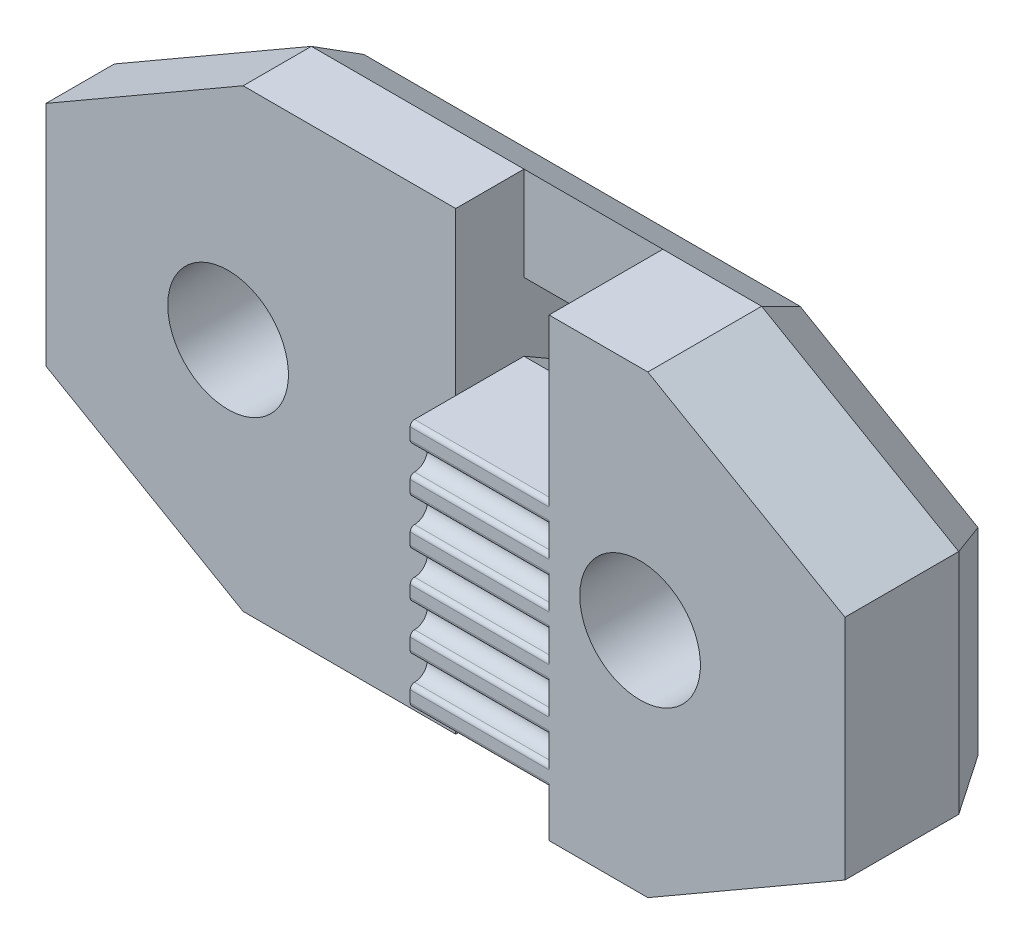
from build123d import *
from OCP.BRepFilletAPI import BRepFilletAPI_MakeChamfer

# Parameters (mm, degrees)
AUFSATZ_LINEAR_AUSTRAGEN1_DEPTH    = 6.1
AUFSATZ_LINEAR_AUSTRAGEN1_2_DEPTH  = 6.1
SKIZZE2_W                          = 6
SKIZZE2_H                          = 10.88
SCHNITT_LINEAR_AUSTRAGEN1_DEPTH    = 6.1
SKIZZE3_R                          = 2.65
SKIZZE3_W                          = 6.1
SKIZZE3_H                          = 4.12
AUFSATZ_LINEAR_AUSTRAGEN2_DEPTH    = 2.19
SKIZZE4_R                          = 2.65
AUFSATZ_LINEAR_AUSTRAGEN3_DEPTH    = 4.81
SKIZZE5_R                          = 2.65
AUFSATZ_LINEAR_AUSTRAGEN4_DEPTH    = 0.19
FASE1_SIZE                         = 5
FASE1_SIZE2                        = 8.660254038
FASE2_SIZE                         = 2
FASE2_SIZE2                        = 1.154700538
SCHNITT_LINEAR_START               = -4
SCHNITT_LINEAR_AUSTRAGEN3_DEPTH    = 2.5
SCHNITT_LINEAR_AUSTRAGEN4_REACH    = 36.325
SKIZZE12_W                         = 5
SKIZZE12_H                         = 6.1
K_RPER_VERSCHIEBEN_KOPIEREN1_ANGLE = 90


with BuildPart() as part:
    # Skizze1 → Aufsatz-Linear austragen1 (new body)
    with BuildSketch(Plane.XY):
        Polygon((0, 0), (0, 9.44), (0, 10.88), (-6, 10.88), (-6, 0), align=None)
    extrude(amount=AUFSATZ_LINEAR_AUSTRAGEN1_DEPTH)

    # Skizze2 → Schnitt-Linear austragen1 (cut)
    with BuildSketch(Plane.XY.offset(6.1)):
        with Locations((-3, 5.44)):
            Rectangle(SKIZZE2_W, SKIZZE2_H)
    extrude(amount=-SCHNITT_LINEAR_AUSTRAGEN1_DEPTH, mode=Mode.SUBTRACT)


with BuildPart() as body_2:
    # Skizze1 → Aufsatz-Linear austragen1 2 (new body)
    with BuildSketch(Plane.XY):
        with BuildLine():
            Line((-7.05, 10.19), (-7.05, 10.69))
            ThreePointArc((-7.05, 10.69), (-7.105649712, 10.824350288), (-7.24, 10.88))
            Line((-7.24, 10.88), (-9.24, 10.88))
            Line((-9.24, 10.88), (-9.24, 0))
            Line((-9.24, 0), (-7.24, 0))
            ThreePointArc((-7.24, 0), (-7.105649712, 0.055649712), (-7.05, 0.19))
            Line((-7.05, 0.19), (-7.05, 0.69))
            ThreePointArc((-7.05, 0.69), (-7.105649712, 0.824350288), (-7.24, 0.88))
            ThreePointArc((-7.24, 0.88), (-7.8, 1.44), (-7.24, 2))
            ThreePointArc((-7.24, 2), (-7.105649712, 2.055649712), (-7.05, 2.19))
            Line((-7.05, 2.19), (-7.05, 2.69))
            ThreePointArc((-7.05, 2.69), (-7.105649712, 2.824350288), (-7.24, 2.88))
            ThreePointArc((-7.24, 2.88), (-7.8, 3.44), (-7.24, 4))
            ThreePointArc((-7.24, 4), (-7.105649712, 4.055649712), (-7.05, 4.19))
            Line((-7.05, 4.19), (-7.05, 4.69))
            ThreePointArc((-7.05, 4.69), (-7.105649712, 4.824350288), (-7.24, 4.88))
            ThreePointArc((-7.24, 4.88), (-7.8, 5.44), (-7.24, 6))
            ThreePointArc((-7.24, 6), (-7.105649712, 6.055649712), (-7.05, 6.19))
            Line((-7.05, 6.19), (-7.05, 6.69))
            ThreePointArc((-7.05, 6.69), (-7.105649712, 6.824350288), (-7.24, 6.88))
            ThreePointArc((-7.24, 6.88), (-7.8, 7.44), (-7.24, 8))
            ThreePointArc((-7.24, 8), (-7.105649712, 8.055649712), (-7.05, 8.19))
            Line((-7.05, 8.19), (-7.05, 8.69))
            ThreePointArc((-7.05, 8.69), (-7.105649712, 8.824350288), (-7.24, 8.88))
            ThreePointArc((-7.24, 8.88), (-7.8, 9.44), (-7.24, 10))
            ThreePointArc((-7.24, 10), (-7.105649712, 10.055649712), (-7.05, 10.19))
        make_face()
    extrude(amount=AUFSATZ_LINEAR_AUSTRAGEN1_2_DEPTH)

    # Skizze3 → Aufsatz-Linear austragen2 (add)
    # profile 1 of 2: a face of its own
    with BuildSketch(Plane.ZY.offset(9.24)):
        Polygon((-13, -2), (0, -2), (0, 13.88), (0, 18), (-13, 18), align=None)
        with Locations((-4, 8)):
            Circle(SKIZZE3_R, mode=Mode.SUBTRACT)
    # profile 2 of 2: a face of its own
    with BuildSketch(Plane.ZY.offset(9.24)):
        with Locations((3.05, 15.94)):
            Rectangle(SKIZZE3_W, SKIZZE3_H)
    extrude(amount=-AUFSATZ_LINEAR_AUSTRAGEN2_DEPTH)

    # Skizze4 → Aufsatz-Linear austragen3 (add)
    # profile 1 of 2: a face of its own
    with BuildSketch(Plane.ZY.offset(9.24)):
        Polygon((24.1, 18), (6.1, 18), (6.1, 13.88), (6.1, 10.88), (6.1, 0), (6.1, -2), (24.1, -2), align=None)
        with Locations((16.1, 8)):
            Circle(SKIZZE4_R, mode=Mode.SUBTRACT)
    # profile 2 of 2: a face of its own
    with BuildSketch(Plane.ZY.offset(9.24)):
        Polygon((6.1, 0), (6.1, 10.88), (0, 10.88), (0, 13.88), (6.1, 13.88), (6.1, 18), (-13, 18), (-13, -2), (0, -2), (0, 0), align=None)
        with Locations((-4, 8)):
            Circle(SKIZZE4_R, mode=Mode.SUBTRACT)
    extrude(amount=AUFSATZ_LINEAR_AUSTRAGEN3_DEPTH)

    # Skizze5 → Aufsatz-Linear austragen4 (add)
    with BuildSketch(Plane(origin=(-9.24, 0, 0), x_dir=(0, 0, -1), z_dir=(1, 0, 0))):
        Polygon((-6.1, 13.88), (-6.1, 18), (-24.1, 18), (-24.1, -2), (-6.1, -2), (-6.1, 0), (-6.1, 10.88), align=None)
        with Locations(Location((-16.1, 8, 0), (0, 0, 180))):
            Circle(SKIZZE5_R, mode=Mode.SUBTRACT)
    extrude(amount=AUFSATZ_LINEAR_AUSTRAGEN4_DEPTH)

    # Fase1: one chamfer whose edges measure the first distance from different faces: ONE call of the kernel's chamfer builder (chamfer() names one face for all edges)
    fase1_edges_1 = [body_2.edges().sort_by_distance(p)[0] for p in [
        (-11.645, -2, 24.1),
        (-11.645, 18, 24.1),
    ]]
    fase1_side_1 = [body_2.faces().sort_by_distance(p)[0] for p in [
        (-11.645, 8, 24.1),
    ]]
    fase1_edges_2 = [body_2.edges().sort_by_distance(p)[0] for p in [
        (-10.55, -2, -13),
        (-10.55, 18, -13),
    ]]
    fase1_side_2 = [body_2.faces().sort_by_distance(p)[0] for p in [
        (-10.55, 8, -13),
    ]]
    fase1 = BRepFilletAPI_MakeChamfer(body_2.part.solid().wrapped)
    for e in fase1_edges_1:
        fase1.Add(FASE1_SIZE, FASE1_SIZE2, e.wrapped, fase1_side_1[0].wrapped)  # the first distance lies on this face
    for e in fase1_edges_2:
        fase1.Add(FASE1_SIZE, FASE1_SIZE2, e.wrapped, fase1_side_2[0].wrapped)  # the first distance lies on this face
    add(Compound.cast(fase1.Shape()), mode=Mode.REPLACE)

    # Fase2: one chamfer whose edges measure the first distance from different faces: ONE call of the kernel's chamfer builder (chamfer() names one face for all edges)
    fase2_edges_1 = [body_2.edges().sort_by_distance(p)[0] for p in [
        (-14.05, -2, 10.769872981),
    ]]
    fase2_side_1 = [body_2.faces().sort_by_distance(p)[0] for p in [
        (-11.645, -2, 10.769872981),
    ]]
    fase2_edges_2 = [body_2.edges().sort_by_distance(p)[0] for p in [
        (-14.05, 10.88, 3.05),
    ]]
    fase2_side_2 = [body_2.faces().sort_by_distance(p)[0] for p in [
        (-11.645, 10.88, 3.05),
    ]]
    fase2_edges_3 = [body_2.edges().sort_by_distance(p)[0] for p in [
        (-14.05, 13.88, 3.05),
    ]]
    fase2_side_3 = [body_2.faces().sort_by_distance(p)[0] for p in [
        (-10.55, 13.88, 3.05),
    ]]
    fase2_edges_4 = [body_2.edges().sort_by_distance(p)[0] for p in [
        (-14.05, 18, 5.55),
    ]]
    fase2_side_4 = [body_2.faces().sort_by_distance(p)[0] for p in [
        (-10.939880768, 18, 4.735948766),
    ]]
    fase2_edges_5 = [body_2.edges().sort_by_distance(p)[0] for p in [
        (-14.05, 8, 24.1),
    ]]
    fase2_side_5 = [body_2.faces().sort_by_distance(p)[0] for p in [
        (-11.645, 8, 24.1),
    ]]
    fase2_edges_6 = [body_2.edges().sort_by_distance(p)[0] for p in [
        (-14.05, 8, -13),
    ]]
    fase2_side_6 = [body_2.faces().sort_by_distance(p)[0] for p in [
        (-10.55, 8, -13),
    ]]
    fase2_edges_7 = [body_2.edges().sort_by_distance(p)[0] for p in [
        (-14.05, -2, -2.169872981),
    ]]
    fase2_side_7 = [body_2.faces().sort_by_distance(p)[0] for p in [
        (-10.55, -2, -2.169872981),
    ]]
    fase2_edges_8 = [body_2.edges().sort_by_distance(p)[0] for p in [
        (-14.05, 0.5, -8.669872981),
    ]]
    fase2_side_8 = [body_2.faces().sort_by_distance(p)[0] for p in [
        (-10.55, 0.5, -8.669872981),
    ]]
    fase2_edges_9 = [body_2.edges().sort_by_distance(p)[0] for p in [
        (-14.05, 0.5, 19.769872981),
    ]]
    fase2_side_9 = [body_2.faces().sort_by_distance(p)[0] for p in [
        (-11.645, 0.5, 19.769872981),
    ]]
    fase2_edges_10 = [body_2.edges().sort_by_distance(p)[0] for p in [
        (-14.05, 15.5, 19.769872981),
    ]]
    fase2_side_10 = [body_2.faces().sort_by_distance(p)[0] for p in [
        (-11.645, 15.5, 19.769872981),
    ]]
    fase2_edges_11 = [body_2.edges().sort_by_distance(p)[0] for p in [
        (-14.05, 15.5, -8.669872981),
    ]]
    fase2_side_11 = [body_2.faces().sort_by_distance(p)[0] for p in [
        (-10.55, 15.5, -8.669872981),
    ]]
    fase2 = BRepFilletAPI_MakeChamfer(body_2.part.solid().wrapped)
    for e in fase2_edges_1:
        fase2.Add(FASE2_SIZE, FASE2_SIZE2, e.wrapped, fase2_side_1[0].wrapped)  # the first distance lies on this face
    for e in fase2_edges_2:
        fase2.Add(FASE2_SIZE, FASE2_SIZE2, e.wrapped, fase2_side_2[0].wrapped)  # the first distance lies on this face
    for e in fase2_edges_3:
        fase2.Add(FASE2_SIZE, FASE2_SIZE2, e.wrapped, fase2_side_3[0].wrapped)  # the first distance lies on this face
    for e in fase2_edges_4:
        fase2.Add(FASE2_SIZE, FASE2_SIZE2, e.wrapped, fase2_side_4[0].wrapped)  # the first distance lies on this face
    for e in fase2_edges_5:
        fase2.Add(FASE2_SIZE, FASE2_SIZE2, e.wrapped, fase2_side_5[0].wrapped)  # the first distance lies on this face
    for e in fase2_edges_6:
        fase2.Add(FASE2_SIZE, FASE2_SIZE2, e.wrapped, fase2_side_6[0].wrapped)  # the first distance lies on this face
    for e in fase2_edges_7:
        fase2.Add(FASE2_SIZE, FASE2_SIZE2, e.wrapped, fase2_side_7[0].wrapped)  # the first distance lies on this face
    for e in fase2_edges_8:
        fase2.Add(FASE2_SIZE, FASE2_SIZE2, e.wrapped, fase2_side_8[0].wrapped)  # the first distance lies on this face
    for e in fase2_edges_9:
        fase2.Add(FASE2_SIZE, FASE2_SIZE2, e.wrapped, fase2_side_9[0].wrapped)  # the first distance lies on this face
    for e in fase2_edges_10:
        fase2.Add(FASE2_SIZE, FASE2_SIZE2, e.wrapped, fase2_side_10[0].wrapped)  # the first distance lies on this face
    for e in fase2_edges_11:
        fase2.Add(FASE2_SIZE, FASE2_SIZE2, e.wrapped, fase2_side_11[0].wrapped)  # the first distance lies on this face
    add(Compound.cast(fase2.Shape()), mode=Mode.REPLACE)

    # Skizze11 → Schnitt-Linear austragen3 (cut)
    with BuildSketch(Plane.XZ.offset(2).offset(SCHNITT_LINEAR_START)):
        with BuildLine():
            Line((-14.05, 7.6), (-14.05, 6.1))
            ThreePointArc((-14.05, 6.1), (-12.989339828, 5.660660172), (-12.55, 4.6))
            Line((-12.55, 4.6), (-12.55, 1.5))
            ThreePointArc((-12.55, 1.5), (-12.989339828, 0.439339828), (-14.05, 0))
            Line((-14.05, 0), (-14.05, -1.5))
            ThreePointArc((-14.05, -1.5), (-11.928679656, -0.621320344), (-11.05, 1.5))
            Line((-11.05, 1.5), (-11.05, 4.6))
            ThreePointArc((-11.05, 4.6), (-11.928679656, 6.721320344), (-14.05, 7.6))
        make_face()
    extrude(amount=-SCHNITT_LINEAR_AUSTRAGEN3_DEPTH, mode=Mode.SUBTRACT)

    # Schnitt-Linear austragen4: up to this plane
    schnitt_linear_austragen4_end = Plane(origin=(-14.05, 15.034700538, 6.1), z_dir=(0.4999999999999981, 0.8660254037844397, 0))
    # Skizze12 → Schnitt-Linear austragen4 (cut, up to the surface)
    with BuildSketch(Plane(origin=(0, 18, 0), x_dir=(1, 0, 0), z_dir=(0, 1, 0)), mode=Mode.PRIVATE) as schnitt_linear_austragen4_sk1:
        with Locations((-9.55, -3.05)):
            Rectangle(SKIZZE12_W, SKIZZE12_H)
    schnitt_linear_austragen4_tool1 = split(extrude(schnitt_linear_austragen4_sk1.sketch, amount=-SCHNITT_LINEAR_AUSTRAGEN4_REACH, mode=Mode.PRIVATE), bisect_by=schnitt_linear_austragen4_end, keep=Keep.BOTH, mode=Mode.PRIVATE)
    add(schnitt_linear_austragen4_tool1.solids().sort_by_distance((-9.55, 18, 3.05))[0], mode=Mode.SUBTRACT)


with BuildPart() as body_2_1:
    # Körper-Verschieben/Kopieren1: moved
    add(body_2.part.rotate(Axis((-10.55, 0, 5.55), (0, -1, 0)), K_RPER_VERSCHIEBEN_KOPIEREN1_ANGLE))


solid = body_2_1.part
